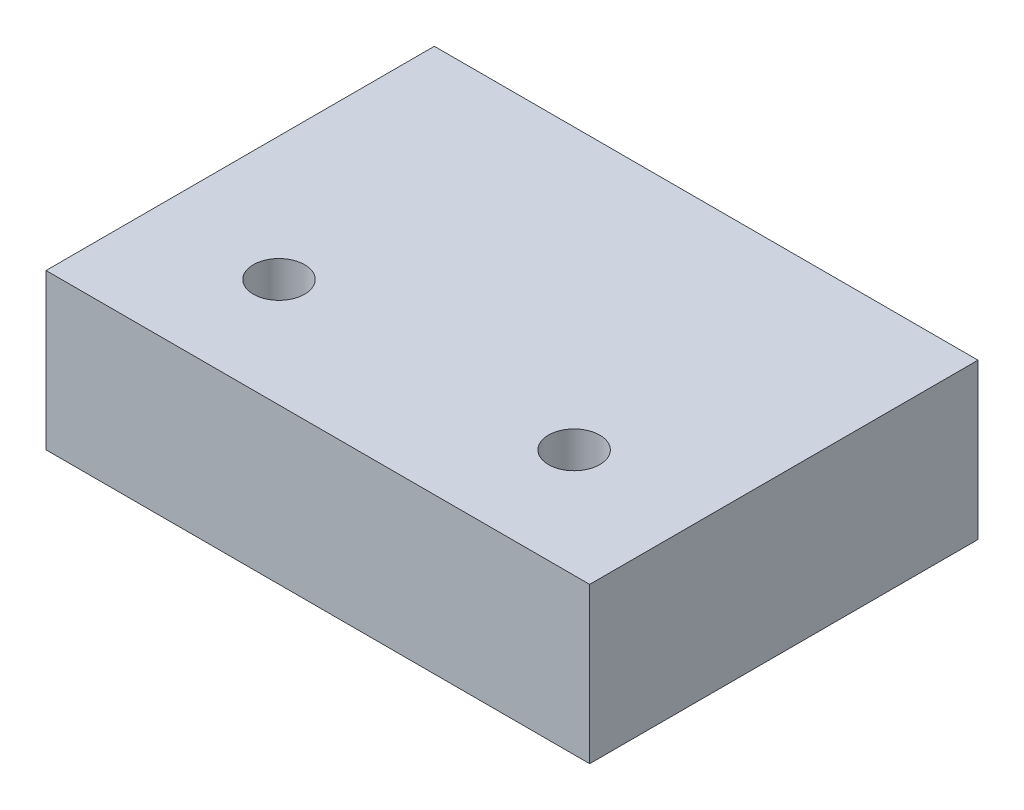
from build123d import *

# Parameters (mm, degrees)
ESQUISSE1_W             = 35
ESQUISSE1_H             = 25
BOSS_EXTRU_1_DEPTH      = 10
ESQUISSE2_R             = 1.65
ENL_V_MAT_EXTRU_1_DEPTH = 10


with BuildPart() as part:
    # Esquisse1 → Boss.-Extru.1 (new body)
    with BuildSketch(Plane(origin=(0, 0, 0), x_dir=(1, 0, 0), z_dir=(0, 1, 0))):
        Rectangle(ESQUISSE1_W, ESQUISSE1_H)
    extrude(amount=BOSS_EXTRU_1_DEPTH)

    # Esquisse2 → Enlèv. mat.-Extru.1 (cut)
    with BuildSketch(Plane(origin=(0, 10, 0), x_dir=(1, 0, 0), z_dir=(0, 1, 0))):
        with Locations((9.5, -5.5)):
            Circle(ESQUISSE2_R)
        with Locations((-9.5, -5.5)):
            Circle(ESQUISSE2_R)
    extrude(amount=-ENL_V_MAT_EXTRU_1_DEPTH, mode=Mode.SUBTRACT)


solid = part.part
